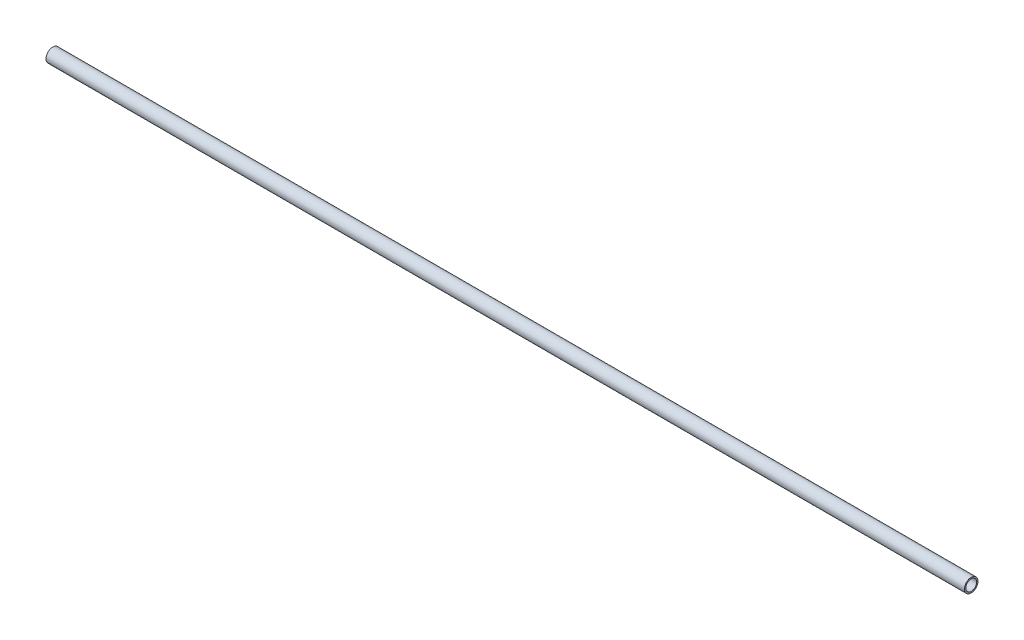
from build123d import *

# Parameters (mm, degrees)
SKETCH1_R           = 5
SKETCH1_R_2         = 4
BOSS_EXTRUDE1_DEPTH = 337.5


with BuildPart() as part:
    # Sketch1 → Boss-Extrude1 (new, symmetric)
    with BuildSketch(Plane(origin=(0, 0, 0), x_dir=(0, 0, -1), z_dir=(1, 0, 0))):
        Circle(SKETCH1_R)
        Circle(SKETCH1_R_2, mode=Mode.SUBTRACT)
    extrude(amount=BOSS_EXTRUDE1_DEPTH, both=True)


solid = part.part
